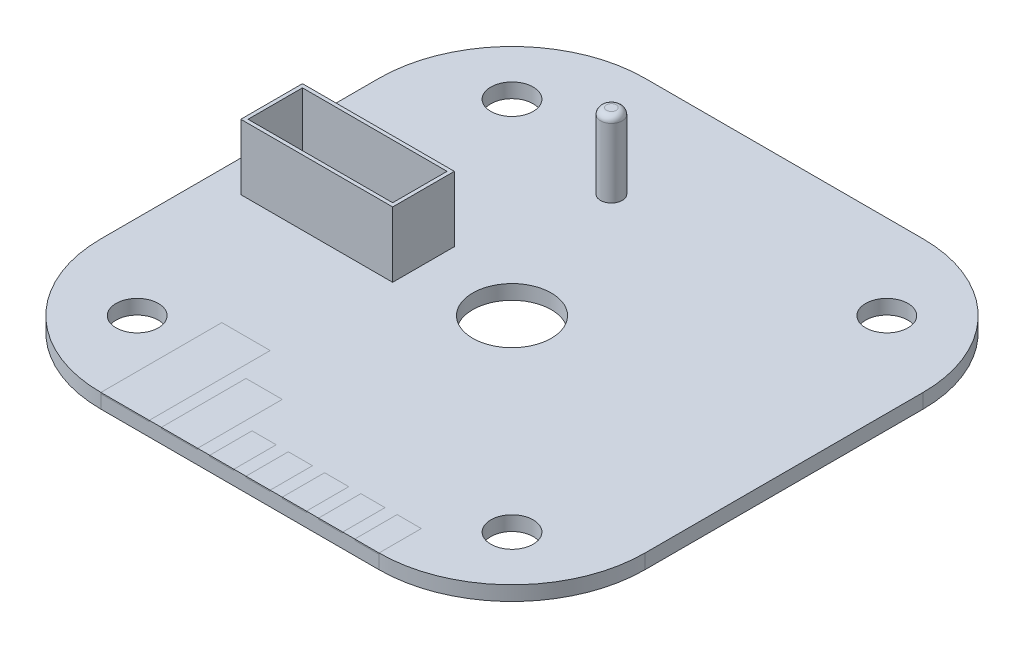
from build123d import *

# Parameters (mm, degrees)
SKETCH1_W               = 45
SKETCH1_H               = 45
BOSS_EXTRUDE1_DEPTH     = 0.6
CUT_EXTRUDE1_DEPTH      = 32.825461505
CUT_EXTRUDE1_DEPTH_BACK = 32.825461505
SKETCH3_R               = 3.25
FILLET1_R               = 11
CUT_EXTRUDE2_DEPTH      = 32.825461505
CUT_EXTRUDE2_DEPTH_BACK = 32.825461505
SKETCH5_R               = 1.75
SKETCH6_W               = 12.56
SKETCH6_H               = 5.1
SKETCH6_W_2             = 11.96
SKETCH6_H_2             = 4.5
EXTRUDE_THIN1_DEPTH     = 5.4
SKETCH7_W               = 11.96
SKETCH7_H               = 4.5
BOSS_EXTRUDE2_DEPTH     = 0.3
SKETCH8_W               = 2
SKETCH8_H               = 3.5
SKETCH8_W_2             = 4
SKETCH8_H_2             = 10
SKETCH8_W_3             = 3
SKETCH8_H_3             = 7
CUT_EXTRUDE3_DEPTH      = 0.1
SKETCH9_W               = 2
SKETCH9_H               = 3.5
BOSS_EXTRUDE3_DEPTH     = 0.1
BOSS_EXTRUDE3_2_DEPTH   = 0.1
BOSS_EXTRUDE3_3_DEPTH   = 0.1
BOSS_EXTRUDE3_4_DEPTH   = 0.1
BOSS_EXTRUDE3_5_DEPTH   = 0.1
SKETCH9_W_2             = 3
SKETCH9_H_2             = 7
BOSS_EXTRUDE3_6_DEPTH   = 0.1
SKETCH9_W_3             = 4
SKETCH9_H_3             = 10
BOSS_EXTRUDE3_7_DEPTH   = 0.1
SKETCH10_R              = 0.9
BOSS_EXTRUDE4_DEPTH     = 6.2
FILLET2_R               = 0.5


with BuildPart() as part:
    # Sketch1 → Boss-Extrude1 (new, symmetric)
    with BuildSketch(Plane(origin=(0, 0, 0), x_dir=(1, 0, 0), z_dir=(0, 1, 0))):
        Rectangle(SKETCH1_W, SKETCH1_H)
    extrude(amount=BOSS_EXTRUDE1_DEPTH, both=True)

    # Sketch3 → Cut-Extrude1 (cut, two sides: drawn at the far end of the back side and taken through both)
    with BuildSketch(Plane(origin=(0, 0, 0), x_dir=(1, 0, 0), z_dir=(0, 1, 0)).offset(-CUT_EXTRUDE1_DEPTH_BACK)):
        with Locations(Location((0, 0, 0), (0, 0, 270))):
            Circle(SKETCH3_R)
    extrude(amount=CUT_EXTRUDE1_DEPTH + CUT_EXTRUDE1_DEPTH_BACK, mode=Mode.SUBTRACT)

    # Fillet1
    fillet1_edges = [part.edges().sort_by_distance(p)[0] for p in [
        (22.5, 0, 22.5),
        (-22.5, 0, 22.5),
        (-22.5, 0, -22.5),
        (22.5, 0, -22.5),
    ]]
    fillet(fillet1_edges, radius=FILLET1_R)

    # Sketch5 → Cut-Extrude2 (cut, two sides: drawn at the far end of the back side and taken through both)
    with BuildSketch(Plane(origin=(0, 0, 0), x_dir=(1, 0, 0), z_dir=(0, 1, 0)).offset(-CUT_EXTRUDE2_DEPTH_BACK)):
        with Locations(Location((-15.5, 15.5, 0), (0, 0, 270))):
            Circle(SKETCH5_R)
        with Locations(Location((15.5, 15.5, 0), (0, 0, 270))):
            Circle(SKETCH5_R)
        with Locations(Location((15.5, -15.5, 0), (0, 0, 270))):
            Circle(SKETCH5_R)
        with Locations(Location((-15.5, -15.5, 0), (0, 0, 270))):
            Circle(SKETCH5_R)
    extrude(amount=CUT_EXTRUDE2_DEPTH + CUT_EXTRUDE2_DEPTH_BACK, mode=Mode.SUBTRACT)

    # Sketch6 → Extrude-Thin1 (add)
    with BuildSketch(Plane(origin=(0, 0.6, 0), x_dir=(1, 0, 0), z_dir=(0, 1, 0))):
        with Locations((-13.6, 0)):
            Rectangle(SKETCH6_W, SKETCH6_H)
        with Locations((-13.6, 0)):
            Rectangle(SKETCH6_W_2, SKETCH6_H_2, mode=Mode.SUBTRACT)
    extrude(amount=EXTRUDE_THIN1_DEPTH)

    # Sketch7 → Boss-Extrude2 (add)
    with BuildSketch(Plane(origin=(0, 0.6, 0), x_dir=(1, 0, 0), z_dir=(0, 1, 0))):
        with Locations((-13.6, 0)):
            Rectangle(SKETCH7_W, SKETCH7_H)
    extrude(amount=BOSS_EXTRUDE2_DEPTH)

    # Sketch8 → Cut-Extrude3 (cut)
    with BuildSketch(Plane(origin=(0, 0.6, 0), x_dir=(1, 0, 0), z_dir=(0, 1, 0))):
        with Locations((-1.5, -20.75)):
            Rectangle(SKETCH8_W, SKETCH8_H)
        with Locations((1.5, -20.75)):
            Rectangle(SKETCH8_W, SKETCH8_H)
        with Locations((4.5, -20.75)):
            Rectangle(SKETCH8_W, SKETCH8_H)
        with Locations((7.5, -20.75)):
            Rectangle(SKETCH8_W, SKETCH8_H)
        with Locations((10.5, -20.75)):
            Rectangle(SKETCH8_W, SKETCH8_H)
        with Locations((-9.5, -17.5)):
            Rectangle(SKETCH8_W_2, SKETCH8_H_2)
        with Locations((-5, -19)):
            Rectangle(SKETCH8_W_3, SKETCH8_H_3)
    extrude(amount=-CUT_EXTRUDE3_DEPTH, mode=Mode.SUBTRACT)

    # Sketch10 → Boss-Extrude4 (add)
    with BuildSketch(Plane(origin=(0, 0.6, 0), x_dir=(1, 0, 0), z_dir=(0, 1, 0))):
        with Locations(Location((-4.59, 12.81, 0), (0, 0, 90))):
            Circle(SKETCH10_R)
    extrude(amount=BOSS_EXTRUDE4_DEPTH)

    # Fillet2
    fillet2_edges = [part.edges().sort_by_distance(p)[0] for p in [
        (-4.59, 6.8, -11.91),
    ]]
    fillet(fillet2_edges, radius=FILLET2_R)


with BuildPart() as body_2:
    # Sketch9 → Boss-Extrude3 (new body)
    with BuildSketch(Plane(origin=(0, 0.5, 0), x_dir=(1, 0, 0), z_dir=(0, 1, 0))):
        with Locations((10.5, -20.75)):
            Rectangle(SKETCH9_W, SKETCH9_H)
    extrude(amount=BOSS_EXTRUDE3_DEPTH)


with BuildPart() as body_3:
    # Sketch9 → Boss-Extrude3 2 (new body)
    with BuildSketch(Plane(origin=(0, 0.5, 0), x_dir=(1, 0, 0), z_dir=(0, 1, 0))):
        with Locations((7.5, -20.75)):
            Rectangle(SKETCH9_W, SKETCH9_H)
    extrude(amount=BOSS_EXTRUDE3_2_DEPTH)


with BuildPart() as body_4:
    # Sketch9 → Boss-Extrude3 3 (new body)
    with BuildSketch(Plane(origin=(0, 0.5, 0), x_dir=(1, 0, 0), z_dir=(0, 1, 0))):
        with Locations((4.5, -20.75)):
            Rectangle(SKETCH9_W, SKETCH9_H)
    extrude(amount=BOSS_EXTRUDE3_3_DEPTH)


with BuildPart() as body_5:
    # Sketch9 → Boss-Extrude3 4 (new body)
    with BuildSketch(Plane(origin=(0, 0.5, 0), x_dir=(1, 0, 0), z_dir=(0, 1, 0))):
        with Locations((1.5, -20.75)):
            Rectangle(SKETCH9_W, SKETCH9_H)
    extrude(amount=BOSS_EXTRUDE3_4_DEPTH)


with BuildPart() as body_6:
    # Sketch9 → Boss-Extrude3 5 (new body)
    with BuildSketch(Plane(origin=(0, 0.5, 0), x_dir=(1, 0, 0), z_dir=(0, 1, 0))):
        with Locations((-1.5, -20.75)):
            Rectangle(SKETCH9_W, SKETCH9_H)
    extrude(amount=BOSS_EXTRUDE3_5_DEPTH)


with BuildPart() as body_7:
    # Sketch9 → Boss-Extrude3 6 (new body)
    with BuildSketch(Plane(origin=(0, 0.5, 0), x_dir=(1, 0, 0), z_dir=(0, 1, 0))):
        with Locations((-5, -19)):
            Rectangle(SKETCH9_W_2, SKETCH9_H_2)
    extrude(amount=BOSS_EXTRUDE3_6_DEPTH)


with BuildPart() as body_8:
    # Sketch9 → Boss-Extrude3 7 (new body)
    with BuildSketch(Plane(origin=(0, 0.5, 0), x_dir=(1, 0, 0), z_dir=(0, 1, 0))):
        with Locations((-9.5, -17.5)):
            Rectangle(SKETCH9_W_3, SKETCH9_H_3)
    extrude(amount=BOSS_EXTRUDE3_7_DEPTH)


solid = Compound([part.part, body_2.part, body_3.part, body_4.part, body_5.part, body_6.part, body_7.part, body_8.part])
